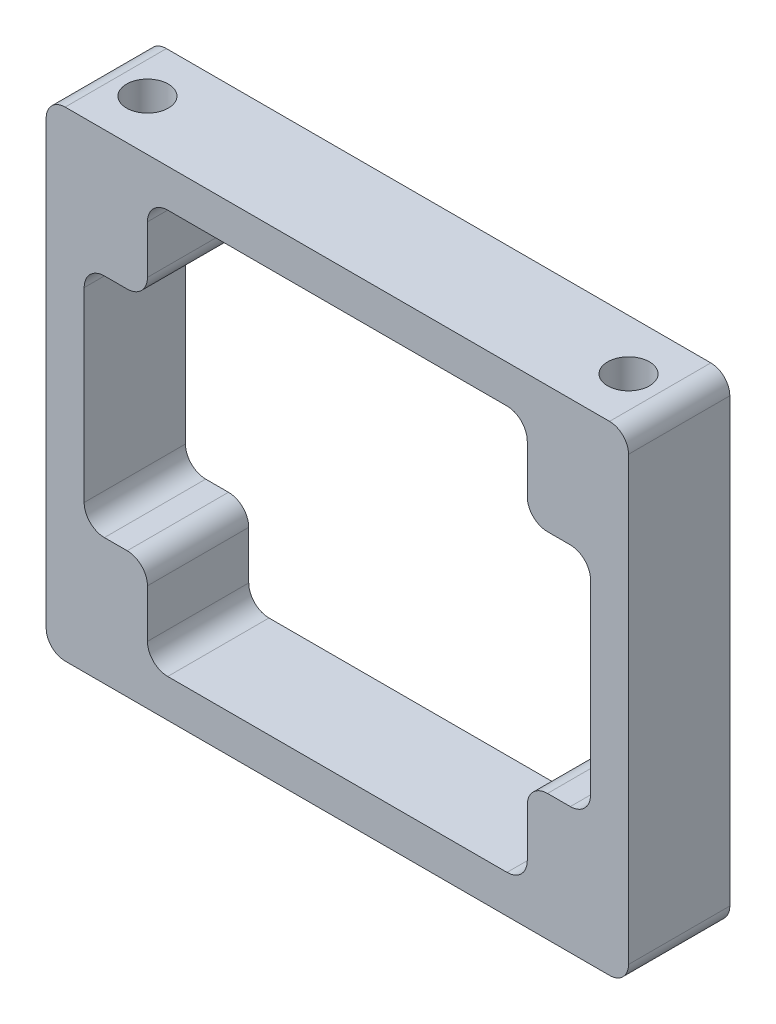
from build123d import *

# Parameters (mm, degrees)
SKETCH_1_W                  = 46
SKETCH_1_H                  = 37.9
EXTRUDE_1_DEPTH             = 4
HOLE_WIZARD_M4_1_AT_2_COUNT = 2
HOLE_WIZARD_M4_1_AT_2_PITCH = 38
SKETCH_5_W                  = 30
SKETCH_5_H                  = 31.9
CUT_EXTRUDE_1_DEPTH         = 19
SKETCH_6_W                  = 40
SKETCH_6_H                  = 17.9
CUT_EXTRUDE_2_DEPTH         = 34
FILLET_1_R                  = 1.6
FILLET_2_R                  = 1.5


with BuildPart() as part:
    # 草图1 → 凸台-拉伸1 (new, symmetric)
    with BuildSketch(Plane.XY):
        Rectangle(SKETCH_1_W, SKETCH_1_H)
    extrude(amount=EXTRUDE_1_DEPTH, both=True)

    # 草图4 → M4 螺纹孔1 (revolve, cut)
    with BuildSketch(Plane(origin=(-19, 18.95, 0), x_dir=(0, 0, 1), z_dir=(1, 0, 0))):
        Polygon((0, 0), (0, 9.591420021), (1.65, 8.6), (1.65, 0), align=None)
    hole_wizard_m4_1 = revolve(axis=Axis((-19, 25.3, 0), (0, -1, 0)), mode=Mode.SUBTRACT)

    # M4 螺纹孔1 at 2: M4 螺纹孔1 ×2
    with Locations(*[(i * HOLE_WIZARD_M4_1_AT_2_PITCH, 0, 0) for i in range(1, HOLE_WIZARD_M4_1_AT_2_COUNT)]):
        add(hole_wizard_m4_1, mode=Mode.SUBTRACT)

    # 镜向1: M4 螺纹孔1 across plane
    add(hole_wizard_m4_1.mirror(Plane.ZX), mode=Mode.SUBTRACT)

    # 镜向1 copy 1 sketch → 镜向1 copy 1 (revolve, cut)
    with BuildSketch(Plane(origin=(19, -18.95, 0), x_dir=(0, 0, 1), z_dir=(1, 0, 0))):
        Polygon((0, 0), (0, -9.591420021), (1.65, -8.6), (1.65, 0), align=None)
    revolve(axis=Axis((19, -25.3, 0), (0, -1, 0)), mode=Mode.SUBTRACT)

    # 草图5 → 切除-拉伸1 (cut, symmetric)
    with BuildSketch(Plane.XY.offset(4)):
        Rectangle(SKETCH_5_W, SKETCH_5_H)
    extrude(amount=CUT_EXTRUDE_1_DEPTH, both=True, mode=Mode.SUBTRACT)

    # 草图6 → 切除-拉伸2 (cut, symmetric)
    with BuildSketch(Plane.XY.offset(4)):
        Rectangle(SKETCH_6_W, SKETCH_6_H)
    extrude(amount=CUT_EXTRUDE_2_DEPTH, both=True, mode=Mode.SUBTRACT)

    # 圆角1
    fillet_1_edges = [part.edges().sort_by_distance(p)[0] for p in [
        (15, 15.95, 0),
        (15, -15.95, 0),
        (-15, -15.95, 0),
        (-15, 15.95, 0),
        (-15, 8.95, 0),
        (-15, -8.95, 0),
        (20, 8.95, 0),
        (-20, -8.95, 0),
        (20, -8.95, 0),
        (15, -8.95, 0),
        (15, 8.95, 0),
        (-20, 8.95, 0),
    ]]
    fillet(fillet_1_edges, radius=FILLET_1_R)

    # 圆角2
    fillet_2_edges = [part.edges().sort_by_distance(p)[0] for p in [
        (23, -18.95, 0),
        (-23, -18.95, 0),
        (-23, 18.95, 0),
        (23, 18.95, 0),
    ]]
    fillet(fillet_2_edges, radius=FILLET_2_R)


solid = part.part
